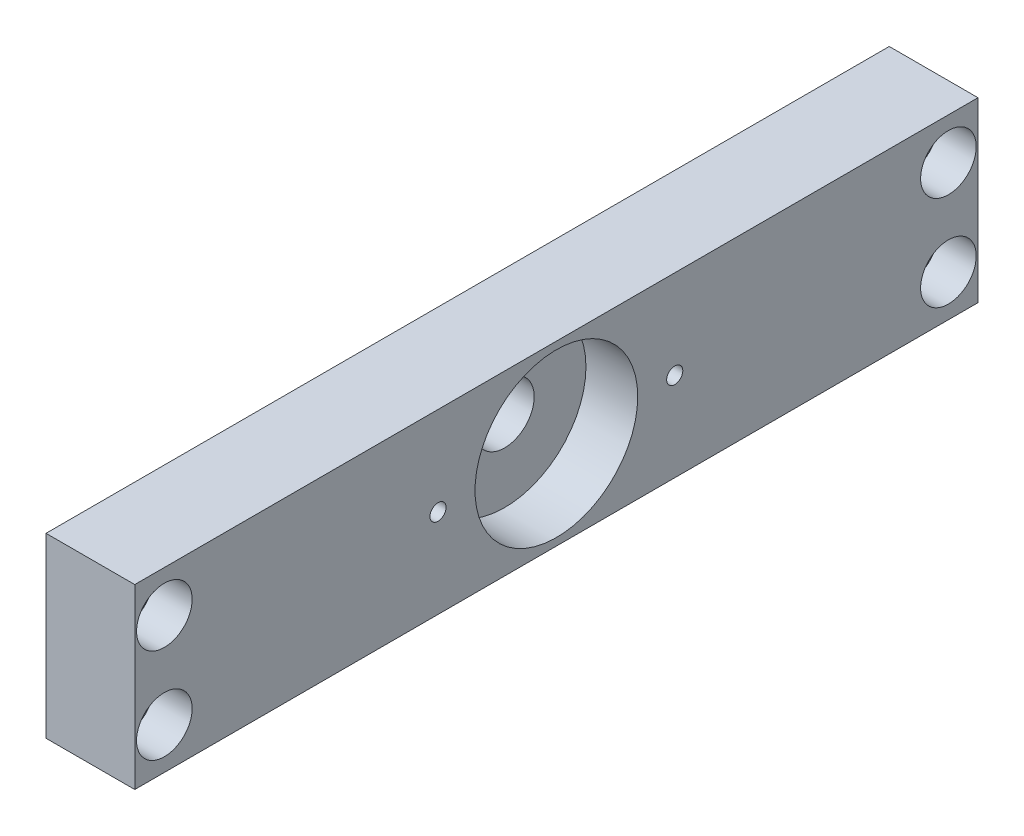
from build123d import *

# Parameters (mm, degrees)
SKETCH1_W           = 180.975
SKETCH1_H           = 38.1
SKETCH1_R           = 6.35
SKETCH1_R_2         = 1.7272
SKETCH1_R_3         = 4.2164
BOSS_EXTRUDE1_DEPTH = 19.05
SKETCH2_R           = 5.969
CUT_EXTRUDE2_DEPTH  = 8.255
SKETCH3_R           = 17.4625
CUT_EXTRUDE3_DEPTH  = 11.1125


with BuildPart() as part:
    # Sketch1 → Boss-Extrude1 (new body)
    with BuildSketch(Plane(origin=(0, 0, 0), x_dir=(0, 0, -1), z_dir=(1, 0, 0))):
        Rectangle(SKETCH1_W, SKETCH1_H)
        with Locations(Location((0, 0, 0), (0, 0, 180))):
            Circle(SKETCH1_R, mode=Mode.SUBTRACT)
        with Locations(Location((-25.4, 0, 0), (0, 0, 180))):
            Circle(SKETCH1_R_2, mode=Mode.SUBTRACT)
        with Locations(Location((-84.1375, 10.16, 0), (0, 0, 180))):
            Circle(SKETCH1_R_3, mode=Mode.SUBTRACT)
        with Locations(Location((-84.1375, -10.16, 0), (0, 0, 180))):
            Circle(SKETCH1_R_3, mode=Mode.SUBTRACT)
        with Locations(Location((25.4, 0, 0), (0, 0, 180))):
            Circle(SKETCH1_R_2, mode=Mode.SUBTRACT)
        with Locations(Location((84.1375, -10.16, 0), (0, 0, 180))):
            Circle(SKETCH1_R_3, mode=Mode.SUBTRACT)
        with Locations(Location((84.1375, 10.16, 0), (0, 0, 180))):
            Circle(SKETCH1_R_3, mode=Mode.SUBTRACT)
    extrude(amount=BOSS_EXTRUDE1_DEPTH)

    # Sketch2 → Cut-Extrude2 (cut)
    with BuildSketch(Plane(origin=(19.05, 0, 0), x_dir=(0, 0, -1), z_dir=(1, 0, 0))):
        with Locations((-84.1375, 10.16)):
            Circle(SKETCH2_R)
        with Locations(Location((-84.1375, -10.16, 0), (0, 0, 180))):
            Circle(SKETCH2_R)
        with Locations((84.1375, -10.16)):
            Circle(SKETCH2_R)
        with Locations(Location((84.1375, 10.16, 0), (0, 0, 180))):
            Circle(SKETCH2_R)
    extrude(amount=-CUT_EXTRUDE2_DEPTH, mode=Mode.SUBTRACT)

    # Sketch3 → Cut-Extrude3 (cut)
    with BuildSketch(Plane(origin=(19.05, 0, 0), x_dir=(0, 0, -1), z_dir=(1, 0, 0))):
        Circle(SKETCH3_R)
    extrude(amount=-CUT_EXTRUDE3_DEPTH, mode=Mode.SUBTRACT)


solid = part.part
